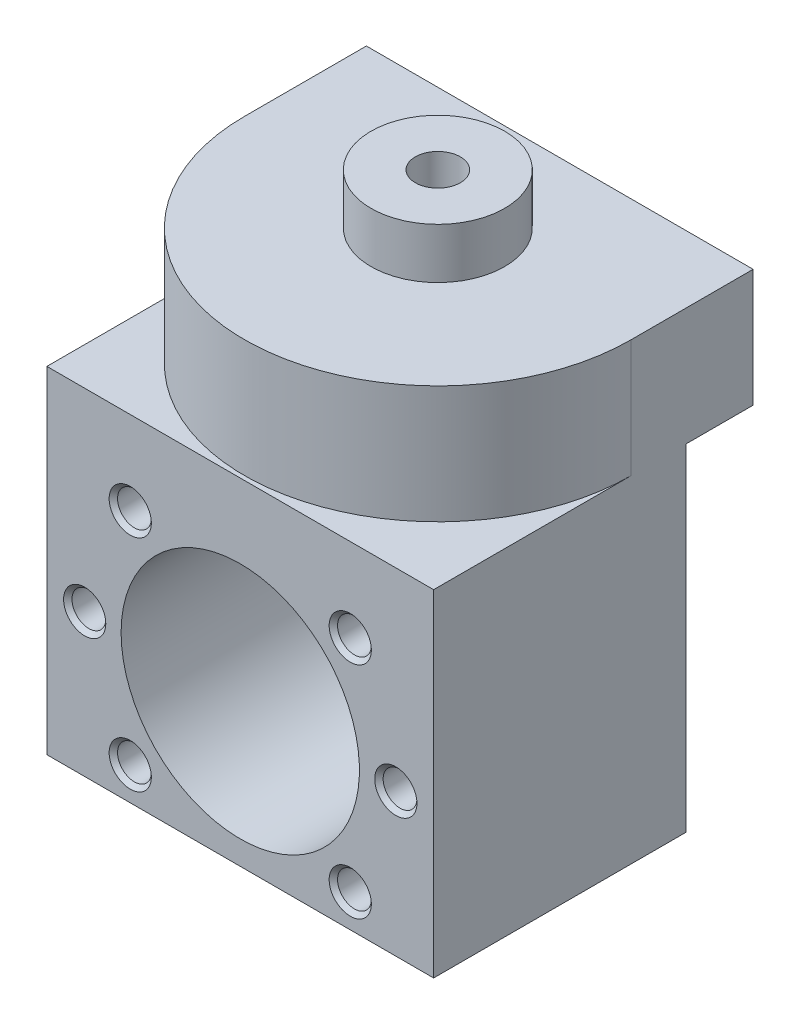
from build123d import *

# Parameters (mm, degrees)
SKETCH1_W                  = 58.42
SKETCH1_H                  = 38.1
BOSS_EXTRUDE1_DEPTH        = 50.8
BOSS_EXTRUDE3_DEPTH        = 17.78
SKETCH3_R                  = 10.0965
BOSS_EXTRUDE4_DEPTH        = 7.62
SKETCH8_R                  = 18
CUT_EXTRUDE2_DEPTH         = 91.06261211
M8X1_25_TAPPED_HOLE1_D     = 6.8
M8X1_25_TAPPED_HOLE1_DEPTH = 25.4
M8X1_25_TAPPED_HOLE1_TIP   = 2.042926105
CIRPATTERN2_COUNT          = 8


with BuildPart() as part:
    # Sketch1 → Boss-Extrude1 (new body)
    with BuildSketch(Plane(origin=(0, 0, 0), x_dir=(1, 0, 0), z_dir=(0, 1, 0))):
        Rectangle(SKETCH1_W, SKETCH1_H)
    extrude(amount=BOSS_EXTRUDE1_DEPTH)

    # Sketch2 → Boss-Extrude3 (add)
    with BuildSketch(Plane(origin=(0, 50.8, 0), x_dir=(-1, 0, 0), z_dir=(0, 1, 0))):
        with BuildLine():
            Line((29.21, -29.21), (29.21, -10.795))
            ThreePointArc((29.21, -10.795), (20.654589078, 9.859589078), (0, 18.415))
            ThreePointArc((0, 18.415), (-20.654589078, 9.859589078), (-29.21, -10.795))
            Line((-29.21, -10.795), (-29.21, -29.21))
            Line((-29.21, -29.21), (29.21, -29.21))
        make_face()
    extrude(amount=BOSS_EXTRUDE3_DEPTH)

    # Sketch3 → Boss-Extrude4 (add)
    with BuildSketch(Plane(origin=(0, 68.58, 0), x_dir=(-1, 0, 0), z_dir=(0, 1, 0))):
        with Locations(Location((0, -10.795, 0), (0, 0, 270))):
            Circle(SKETCH3_R)
    extrude(amount=BOSS_EXTRUDE4_DEPTH)

    # Sketch8 → Cut-Extrude2 (cut, through all)
    with BuildSketch(Plane(origin=(0, 0, -19.05), x_dir=(-1, 0, 0), z_dir=(0, 0, -1))):
        with Locations((0, 21.59)):
            Circle(SKETCH8_R)
    extrude(amount=-CUT_EXTRUDE2_DEPTH, mode=Mode.SUBTRACT)

    # M8x1.25 Tapped Hole1
    with Locations(Plane(origin=(0, 76.2, 0), x_dir=(-1, 0, 0), z_dir=(0, 1, 0))):
        with Locations((0, -10.795)):
            Hole(M8X1_25_TAPPED_HOLE1_D / 2, depth=M8X1_25_TAPPED_HOLE1_DEPTH)
            with Locations((0, 0, -(M8X1_25_TAPPED_HOLE1_DEPTH + M8X1_25_TAPPED_HOLE1_TIP / 2))):  # 118° drill point
                Cone(0, M8X1_25_TAPPED_HOLE1_D / 2, M8X1_25_TAPPED_HOLE1_TIP, mode=Mode.SUBTRACT)

    # Sketch13 → 1/4-20 Tapped Hole1 (revolve, cut)
    with BuildSketch(Plane(origin=(-23.5, 21.59, -19.05), x_dir=(0, 1, 0), z_dir=(1, 0, 0))):
        Polygon((0, 0), (0, 20.583816902), (2.5527, 19.05), (2.5527, 0.635), (3.1877, 0), align=None)
    f_1_4_20_tapped_hole1 = revolve(axis=Axis((-23.5, 21.59, -25.4), (0, 0, 1)), mode=Mode.SUBTRACT)

    # CirPattern2: 1/4-20 Tapped Hole1 ×8 about axis, 2 skipped
    cirpattern2_axis = Axis((0, 21.59, 0), (0, 0, -1))
    add([f_1_4_20_tapped_hole1.rotate(cirpattern2_axis, i * 360 / CIRPATTERN2_COUNT) for i in range(1, CIRPATTERN2_COUNT) if i not in (2, 6)], mode=Mode.SUBTRACT)

    # Mirror2: 1/4-20 Tapped Hole1 across plane
    add(f_1_4_20_tapped_hole1.mirror(Plane.XY), mode=Mode.SUBTRACT)

    # Mirror2 copy 1 sketch → Mirror2 copy 1 (revolve, cut)
    with BuildSketch(Plane(origin=(-16.617009358, 38.207009358, 19.05), x_dir=(0.7071067811865475, 0.7071067811865476, 0), z_dir=(0.7071067811865476, -0.7071067811865475, 0))):
        Polygon((0, 0), (0, -20.583816902), (2.5527, -19.05), (2.5527, -0.635), (3.1877, 0), align=None)
    revolve(axis=Axis((-16.617009358, 38.207009358, 25.4), (0, 0, 1)), mode=Mode.SUBTRACT)

    # Mirror2 copy 2 sketch → Mirror2 copy 2 (revolve, cut)
    with BuildSketch(Plane(origin=(16.617009358, 38.207009358, 19.05), x_dir=(0.7071067811865476, -0.7071067811865475, 0), z_dir=(-0.7071067811865475, -0.7071067811865476, 0))):
        Polygon((0, 0), (0, -20.583816902), (2.5527, -19.05), (2.5527, -0.635), (3.1877, 0), align=None)
    revolve(axis=Axis((16.617009358, 38.207009358, 25.4), (0, 0, 1)), mode=Mode.SUBTRACT)

    # Mirror2 copy 3 sketch → Mirror2 copy 3 (revolve, cut)
    with BuildSketch(Plane(origin=(23.5, 21.59, 19.05), x_dir=(0, -1, 0), z_dir=(-1, 0, 0))):
        Polygon((0, 0), (0, -20.583816902), (2.5527, -19.05), (2.5527, -0.635), (3.1877, 0), align=None)
    revolve(axis=Axis((23.5, 21.59, 25.4), (0, 0, 1)), mode=Mode.SUBTRACT)

    # Mirror2 copy 4 sketch → Mirror2 copy 4 (revolve, cut)
    with BuildSketch(Plane(origin=(16.617009358, 4.972990642, 19.05), x_dir=(-0.7071067811865475, -0.7071067811865477, 0), z_dir=(-0.7071067811865477, 0.7071067811865475, 0))):
        Polygon((0, 0), (0, -20.583816902), (2.5527, -19.05), (2.5527, -0.635), (3.1877, 0), align=None)
    revolve(axis=Axis((16.617009358, 4.972990642, 25.4), (0, 0, 1)), mode=Mode.SUBTRACT)

    # Mirror2 copy 5 sketch → Mirror2 copy 5 (revolve, cut)
    with BuildSketch(Plane(origin=(-16.617009358, 4.972990642, 19.05), x_dir=(-0.7071067811865477, 0.7071067811865474, 0), z_dir=(0.7071067811865474, 0.7071067811865477, 0))):
        Polygon((0, 0), (0, -20.583816902), (2.5527, -19.05), (2.5527, -0.635), (3.1877, 0), align=None)
    revolve(axis=Axis((-16.617009358, 4.972990642, 25.4), (0, 0, 1)), mode=Mode.SUBTRACT)


solid = part.part
